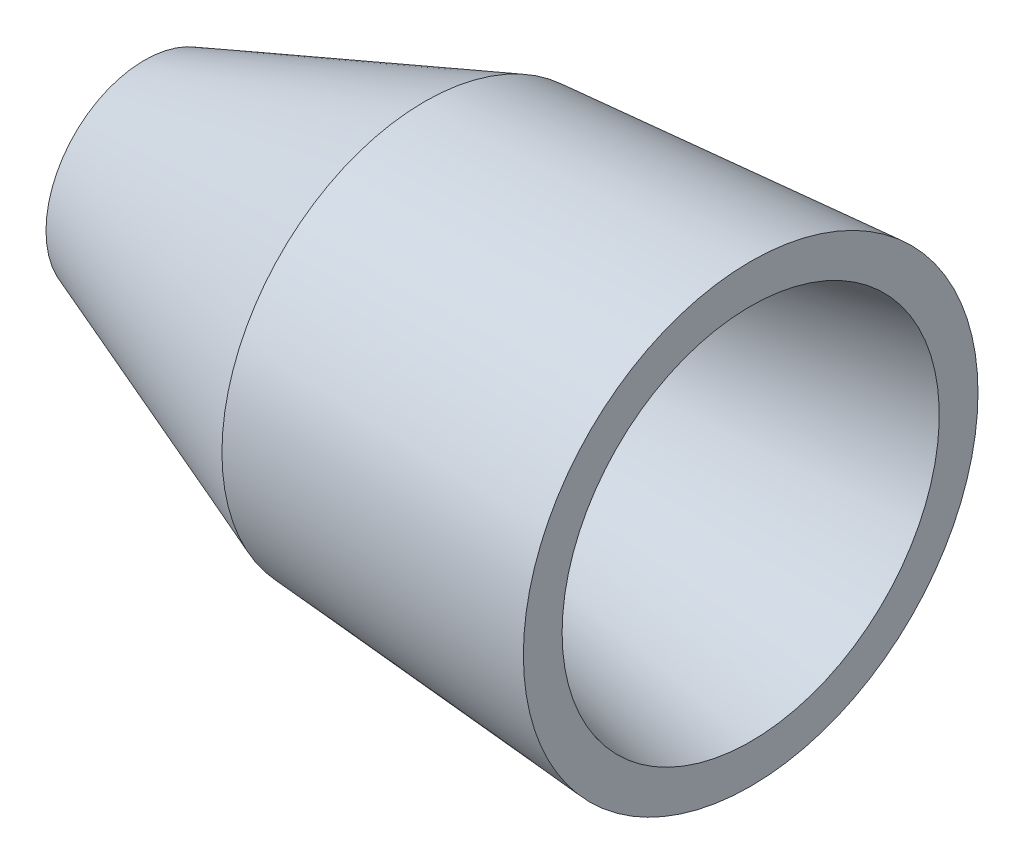
from build123d import *

# Parameters (mm, degrees)
SKETCH6_R           = 13
BOSS_EXTRUDE1_DEPTH = 10
SKETCH7_R           = 1.5
CUT_EXTRUDE1_DEPTH  = 10


with BuildPart() as part:
    # Sketch2 → Revolve5 (revolve)
    with BuildSketch(Plane.XY, mode=Mode.PRIVATE) as revolve5_sk:
        Polygon((0, 13), (0, 7.888355817), (80, 24.888355817), (80, 30), (36.968539733, 26.749080476), align=None)
    revolve(revolve5_sk.sketch.rotate(Axis((0, 0, 0), (1, 0, 0)), 90), axis=Axis((0, 0, 0), (1, 0, 0)))

    # Sketch6 → Boss-Extrude1 (add)
    with BuildSketch(Plane.ZY):
        Circle(SKETCH6_R)
    extrude(amount=-BOSS_EXTRUDE1_DEPTH)

    # Sketch7 → Cut-Extrude1 (cut)
    with BuildSketch(Plane.ZY):
        with Locations((0, 8)):
            Circle(SKETCH7_R)
        with Locations((0, -8)):
            Circle(SKETCH7_R)
        with Locations((8, 0)):
            Circle(SKETCH7_R)
        with Locations((-8, 0)):
            Circle(SKETCH7_R)
    extrude(amount=-CUT_EXTRUDE1_DEPTH, mode=Mode.SUBTRACT)


solid = part.part
